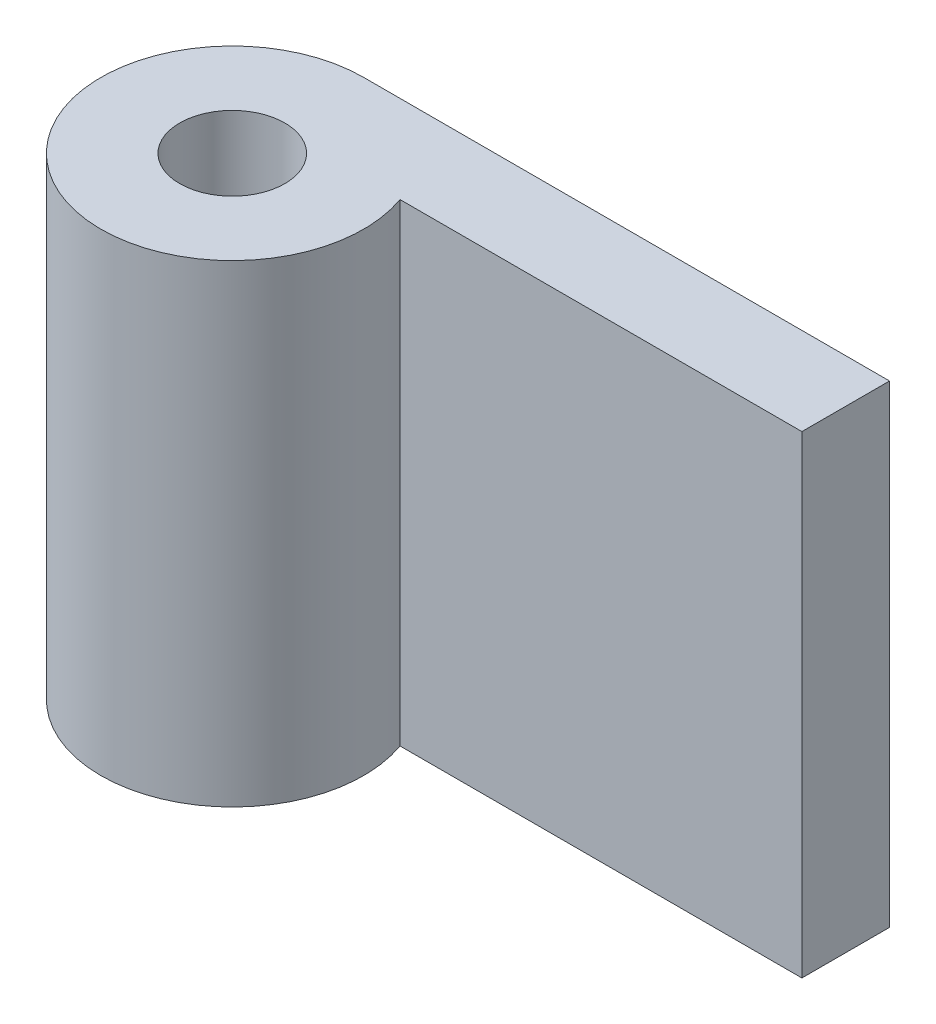
from build123d import *

# Parameters (mm, degrees)
SKETCH_1_R      = 3
EXTRUDE_1_DEPTH = 10.8
SKETCH_7_W      = 2
SKETCH_7_H      = 10.8
EXTRUDE_2_DEPTH = 12
ST2_2_1_D       = 2.4
ST2_2_1_DEPTH   = 8
ST2_2_1_TIP     = 0.721032743


with BuildPart() as part:
    # 草图1 → 凸台-拉伸1 (new body)
    with BuildSketch(Plane(origin=(0, 0, 0), x_dir=(1, 0, 0), z_dir=(0, 1, 0))):
        with Locations(Location((0, 0, 0), (0, 0, 90))):
            Circle(SKETCH_1_R)
    extrude(amount=EXTRUDE_1_DEPTH)

    # 草图7 → 凸台-拉伸2 (add)
    with BuildSketch(Plane(origin=(0, 0, 0), x_dir=(0, 0, -1), z_dir=(1, 0, 0))):
        with Locations((2, 5.4)):
            Rectangle(SKETCH_7_W, SKETCH_7_H)
    extrude(amount=EXTRUDE_2_DEPTH)

    # ST2.2 间隙孔1
    with Locations(Plane.ZX.offset(10.8)):
        with Locations((0, 0)):
            Hole(ST2_2_1_D / 2, depth=ST2_2_1_DEPTH)
            with Locations((0, 0, -(ST2_2_1_DEPTH + ST2_2_1_TIP / 2))):  # 118° drill point
                Cone(0, ST2_2_1_D / 2, ST2_2_1_TIP, mode=Mode.SUBTRACT)


solid = part.part
